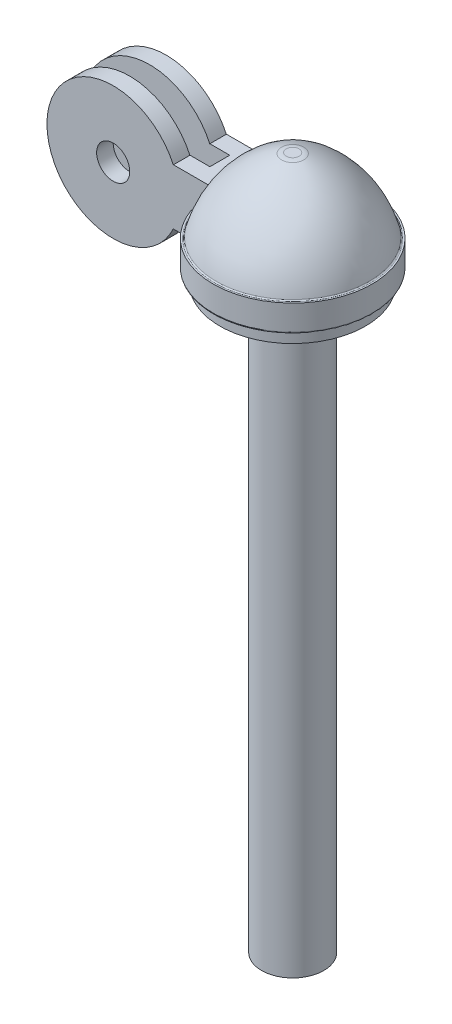
from build123d import *

# Parameters (mm, degrees)
FILLET2_R           = 0.254
SKETCH4_R           = 13.97
BOSS_EXTRUDE1_DEPTH = 2.54
SKETCH6_R           = 5.969
BOSS_EXTRUDE2_DEPTH = 110.998
SKETCH12_W          = 10.16
SKETCH12_H          = 10.668
BOSS_EXTRUDE4_DEPTH = 7.62
SKETCH13_W          = 3.81
SKETCH13_H          = 10.668
CUT_EXTRUDE1_DEPTH  = 3.81
BOSS_EXTRUDE5_DEPTH = 3.175
BOSS_EXTRUDE6_START = -3.175
BOSS_EXTRUDE6_DEPTH = 3.175
SKETCH18_R          = 3.175
CUT_EXTRUDE2_DEPTH  = 123.763550069
SKETCH19_R          = 4.7625
CUT_EXTRUDE3_DEPTH  = 0.254


with BuildPart() as part:
    # Sketch1 → Revolve4 (revolve)
    with BuildSketch(Plane.XY, mode=Mode.PRIVATE) as revolve4_sk:
        with BuildLine():
            Line((0, 0), (15.24, 0))
            Line((15.24, 0), (15.24, 5.08))
            Line((15.24, 5.08), (14.732, 5.08))
            ThreePointArc((14.732, 5.08), (10.14940683, 13.652359196), (2.126977754, 19.141087107))
            ThreePointArc((2.126977754, 19.141087107), (1.68682187, 19.262939901), (1.231959942, 19.304))
            Line((1.231959942, 19.304), (0, 19.304))
            Line((0, 19.304), (0, 0))
        make_face()
    revolve(revolve4_sk.sketch.rotate(Axis((0, 0, 0), (0, 1, 0)), 90), axis=Axis((0, 0, 0), (0, 1, 0)))

    # Fillet2
    fillet2_edges = [part.edges().sort_by_distance(p)[0] for p in [
        (0, 5.08, 14.732),
        (0, 0, 15.24),
    ]]
    fillet(fillet2_edges, radius=FILLET2_R)

    # Sketch4 → Boss-Extrude1 (add)
    with BuildSketch(Plane.XZ):
        with Locations(Location((0, 0, 0), (0, 0, 270))):
            Circle(SKETCH4_R)
    extrude(amount=BOSS_EXTRUDE1_DEPTH)

    # Sketch6 → Boss-Extrude2 (add)
    with BuildSketch(Plane.XZ.offset(2.54)):
        with Locations(Location((0, 0, 0), (0, 0, 270))):
            Circle(SKETCH6_R)
    extrude(amount=BOSS_EXTRUDE2_DEPTH)

    # Sketch12 → Boss-Extrude4 (add)
    with BuildSketch(Plane(origin=(-10.16, 0, 0), x_dir=(0, 0, -1), z_dir=(1, 0, 0))):
        with Locations((0, 5.588)):
            Rectangle(SKETCH12_W, SKETCH12_H)
    extrude(amount=-BOSS_EXTRUDE4_DEPTH)

    # Sketch13 → Cut-Extrude1 (cut)
    with BuildSketch(Plane.ZY.offset(17.78)):
        with Locations((0, 5.588)):
            Rectangle(SKETCH13_W, SKETCH13_H)
    extrude(amount=-CUT_EXTRUDE1_DEPTH, mode=Mode.SUBTRACT)

    # Sketch14 → Boss-Extrude5 (add)
    with BuildSketch(Plane(origin=(0, 0, 1.905), x_dir=(-1, 0, 0), z_dir=(0, 0, -1))):
        with BuildLine():
            Line((17.78, 10.85352476), (17.78, 0.32247524))
            ThreePointArc((17.78, 0.32247524), (42.037, 5.588), (17.78, 10.85352476))
        make_face()
    extrude(amount=-BOSS_EXTRUDE5_DEPTH)

    # Sketch16 → Boss-Extrude6 (add)
    with BuildSketch(Plane.XY.offset(-1.905).offset(BOSS_EXTRUDE6_START)):
        with BuildLine():
            Line((-17.78, 10.85352476), (-17.78, 0.32247524))
            ThreePointArc((-17.78, 0.32247524), (-42.037, 5.588), (-17.78, 10.85352476))
        make_face()
    extrude(amount=BOSS_EXTRUDE6_DEPTH)

    # Sketch18 → Cut-Extrude2 (cut, through all)
    with BuildSketch(Plane(origin=(0, 0, -5.08), x_dir=(-1, 0, 0), z_dir=(0, 0, -1))):
        with Locations(Location((29.337, 5.588, 0), (0, 0, 90))):
            Circle(SKETCH18_R)
    extrude(amount=-CUT_EXTRUDE2_DEPTH, mode=Mode.SUBTRACT)

    # Sketch19 → Cut-Extrude3 (cut)
    with BuildSketch(Plane.XZ.offset(113.538)):
        with Locations(Location((0, 0, 0), (0, 0, 270))):
            Circle(SKETCH19_R)
    extrude(amount=-CUT_EXTRUDE3_DEPTH, mode=Mode.SUBTRACT)


solid = part.part
